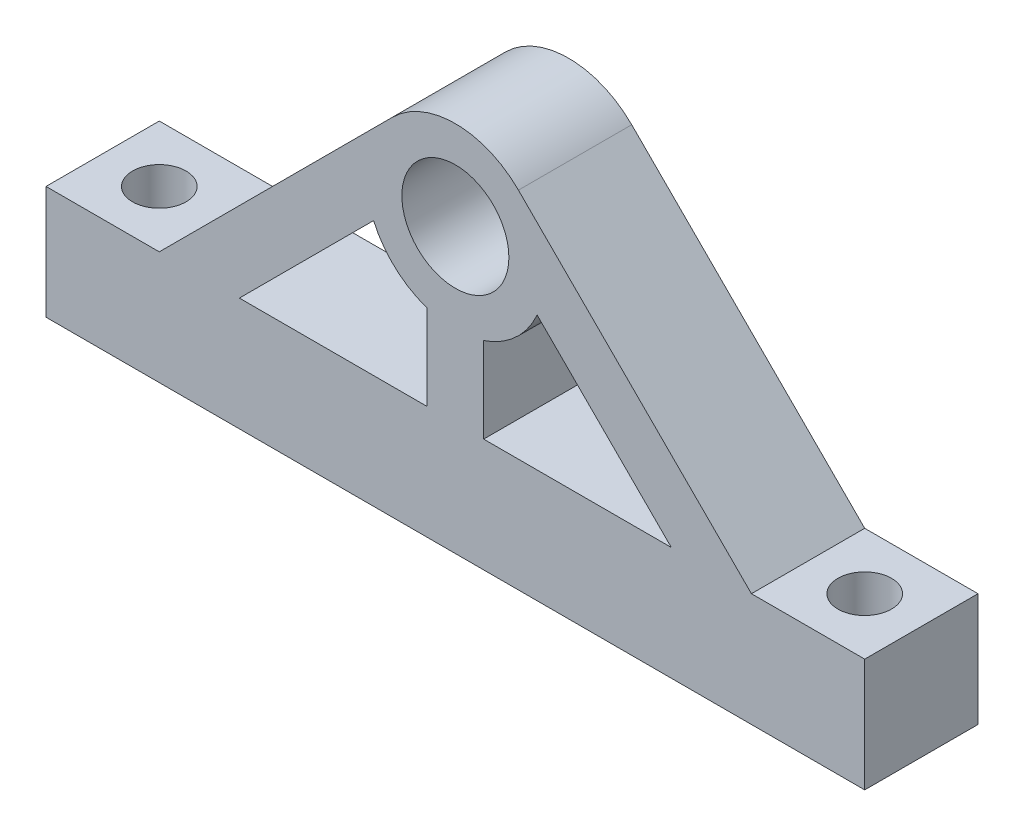
from build123d import *

# Parameters (mm, degrees)
SKETCH1_R           = 5
SKETCH1_R_2         = 3
SKETCH1_W           = 45.892135624
SKETCH1_H           = 6.35
BOSS_EXTRUDE1_DEPTH = 6.35
SKETCH2_R           = 1.5
CUT_EXTRUDE1_DEPTH  = 28.889427262


with BuildPart() as part:
    # Sketch1 → Boss-Extrude1 (new body)
    # profile 1 of 5: a face of its own
    with BuildSketch(Plane.XY):
        Circle(SKETCH1_R)
        Circle(SKETCH1_R_2, mode=Mode.SUBTRACT)
    # profile 2 of 5: a face of its own
    with BuildSketch(Plane.XY):
        with BuildLine():
            ThreePointArc((-4.582078525, -2.001138774), (-4.913002543, 0.92865818), (-3.535533906, 3.535533906))
            Line((-3.535533906, 3.535533906), (-16.596067812, -9.525))
            Line((-16.596067812, -9.525), (-12.105939751, -9.525))
            Line((-12.105939751, -9.525), (-4.582078525, -2.001138774))
        make_face()
    # profile 3 of 5: a face of its own
    with BuildSketch(Plane.XY):
        with Locations((0, -12.7)):
            Rectangle(SKETCH1_W, SKETCH1_H)
    # profile 4 of 5: a face of its own
    with BuildSketch(Plane.XY):
        with BuildLine():
            ThreePointArc((1.5875, -4.741291359), (0, -5), (-1.5875, -4.741291359))
            Line((-1.5875, -4.741291359), (-1.5875, -9.525))
            Line((-1.5875, -9.525), (1.5875, -9.525))
            Line((1.5875, -9.525), (1.5875, -4.741291359))
        make_face()
    # profile 5 of 5: a face of its own
    with BuildSketch(Plane.XY):
        with BuildLine():
            Line((16.596067812, -9.525), (3.535533906, 3.535533906))
            ThreePointArc((3.535533906, 3.535533906), (4.619397663, 1.913417162), (5, 0))
            ThreePointArc((5, 0), (4.894404592, -1.022156391), (4.582078525, -2.001138774))
            Line((4.582078525, -2.001138774), (12.105939751, -9.525))
            Line((12.105939751, -9.525), (16.596067812, -9.525))
        make_face()
    extrude(amount=BOSS_EXTRUDE1_DEPTH)

    # Sketch2 → Cut-Extrude1 (cut, through all)
    with BuildSketch(Plane(origin=(0, -9.525, 0), x_dir=(1, 0, 0), z_dir=(0, 1, 0))):
        with Locations(Location((19.771067812, -3.175, 0), (0, 0, 270))):
            Circle(SKETCH2_R)
        with Locations(Location((-19.771067812, -3.175, 0), (0, 0, 270))):
            Circle(SKETCH2_R)
    extrude(amount=-CUT_EXTRUDE1_DEPTH, mode=Mode.SUBTRACT)


solid = part.part
